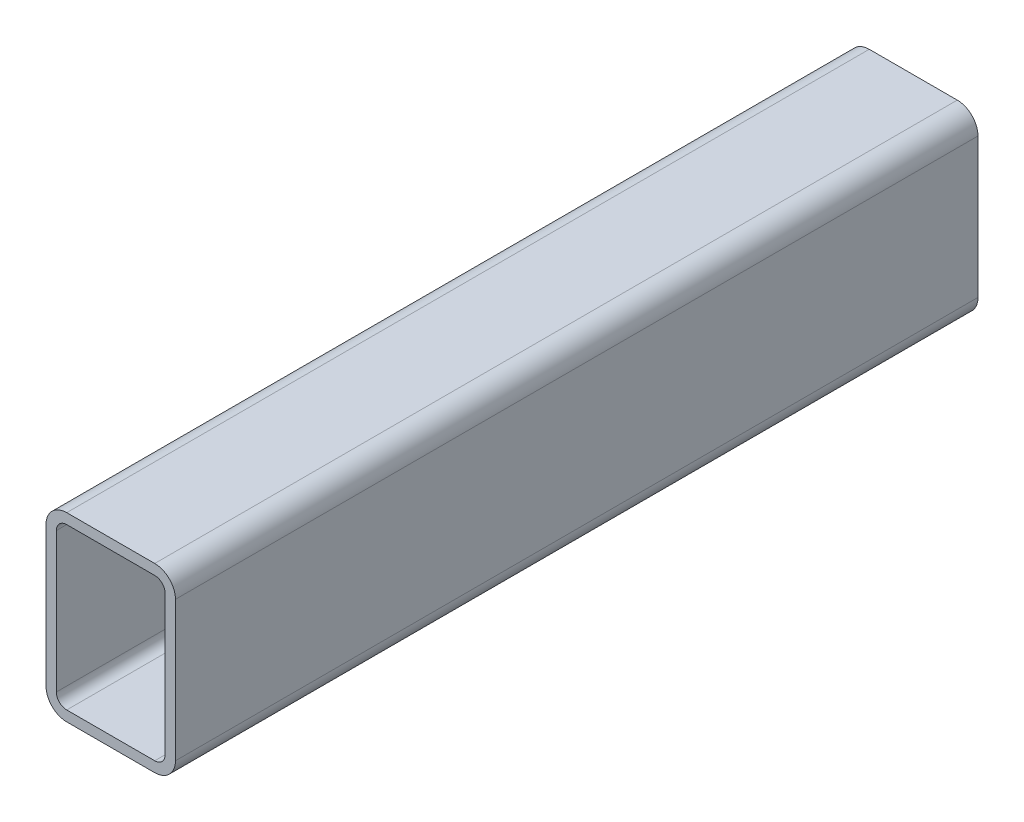
from build123d import *

# Parameters (mm, degrees)
EXTRUDE_1_DEPTH = 155


with BuildPart() as part:
    # Sketch 186 → 凸台-拉伸1 (new, symmetric)
    with BuildSketch(Plane.XY):
        with BuildLine():
            Line((-17, 35), (17, 35))
            ThreePointArc((17, 35), (22.656854249, 32.656854249), (25, 27))
            Line((25, 27), (25, -27))
            ThreePointArc((25, -27), (22.656854249, -32.656854249), (17, -35))
            Line((17, -35), (-17, -35))
            ThreePointArc((-17, -35), (-22.656854249, -32.656854249), (-25, -27))
            Line((-25, -27), (-25, 27))
            ThreePointArc((-25, 27), (-22.656854249, 32.656854249), (-17, 35))
        make_face()
        with BuildLine():
            Line((-17, 31), (17, 31))
            ThreePointArc((17, 31), (19.828427125, 29.828427125), (21, 27))
            Line((21, 27), (21, -27))
            ThreePointArc((21, -27), (19.828427125, -29.828427125), (17, -31))
            Line((17, -31), (-17, -31))
            ThreePointArc((-17, -31), (-19.828427125, -29.828427125), (-21, -27))
            Line((-21, -27), (-21, 27))
            ThreePointArc((-21, 27), (-19.828427125, 29.828427125), (-17, 31))
        make_face(mode=Mode.SUBTRACT)
    extrude(amount=EXTRUDE_1_DEPTH, both=True)


solid = part.part
